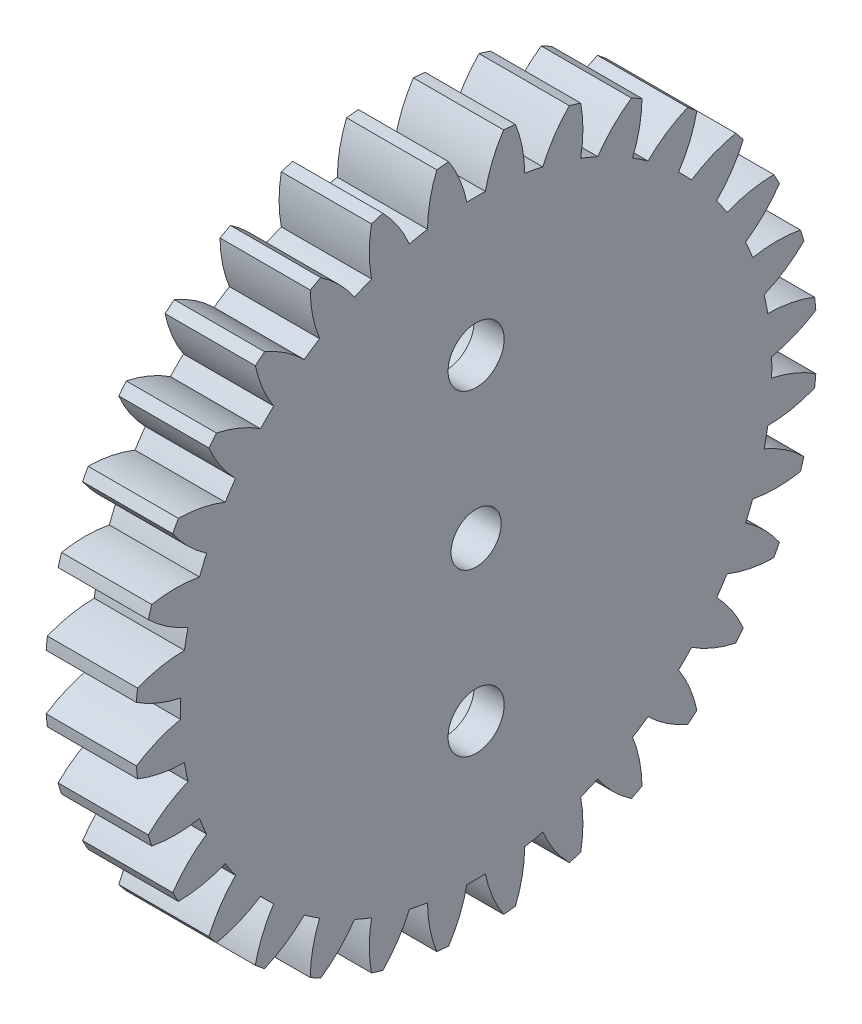
from build123d import *

# Parameters (mm, degrees)
BASPROSKE_W        = 4.5
BASPROSKE_H        = 17
TOOTHCUT_DEPTH     = 25.459149617
TEETHCUTS_COUNT    = 32
TEETHCUTS_ANGLE    = 348.75
BORSKE_R           = 1.25
BORE_DEPTH         = 50.0009652
SKETCH8_R          = 1.4
CUT_EXTRUDE8_DEPTH = 25.382197983
SKETCH9_R          = 2.5
CUT_EXTRUDE9_DEPTH = 3


with BuildPart() as part:
    # BasProSke → Base-Revolve (revolve)
    with BuildSketch(Plane(origin=(0, 0, 0), x_dir=(1, 0, 0), z_dir=(0, 1, 0)), mode=Mode.PRIVATE) as base_revolve_sk:
        with Locations((2.25, 8.5)):
            Rectangle(BASPROSKE_W, BASPROSKE_H)
    revolve(base_revolve_sk.sketch.rotate(Axis((-10, 0, 0), (1, 0, 0)), 180), axis=Axis((-10, 0, 0), (1, 0, 0)))

    # TooCutSke → ToothCut (cut, through all)
    with BuildSketch(Plane(origin=(0, 0, 0), x_dir=(0, 0, -1), z_dir=(1, 0, 0))):
        with BuildLine():
            ThreePointArc((0.462036907, 14.741761187), (0, 14.749), (-0.462036907, 14.741761187))
            ThreePointArc((-0.462036907, 14.741761187), (-0.81854142, 15.899240468), (-1.386721275, 16.9688317))
            ThreePointArc((-1.386721275, 16.9688317), (0, 17.0254), (1.386721275, 16.9688317))
            ThreePointArc((1.386721275, 16.9688317), (0.81854142, 15.899240468), (0.462036907, 14.741761187))
        make_face()
    toothcut = extrude(amount=TOOTHCUT_DEPTH, mode=Mode.SUBTRACT)

    # TeethCuts: ToothCut ×32 about axis
    teethcuts_axis = Axis((-10, 0, 0), (1, 0, 0))
    for i in range(1, TEETHCUTS_COUNT):
        add(toothcut.rotate(teethcuts_axis, i * TEETHCUTS_ANGLE / (TEETHCUTS_COUNT - 1)), mode=Mode.SUBTRACT)

    # BorSke → Bore (cut, symmetric)
    with BuildSketch(Plane(origin=(0, 0, 0), x_dir=(0, 0, -1), z_dir=(1, 0, 0))):
        with Locations(Location((0, 0, 0), (0, 0, 180))):
            Circle(BORSKE_R)
    extrude(amount=BORE_DEPTH, both=True, mode=Mode.SUBTRACT)

    # Sketch8 → Cut-Extrude8 (cut, through all)
    with BuildSketch(Plane(origin=(4.5, 0, 0), x_dir=(0, 0, -1), z_dir=(1, 0, 0))):
        with Locations((0, 7.9)):
            Circle(SKETCH8_R)
        with Locations((0, -7.9)):
            Circle(SKETCH8_R)
    extrude(amount=-CUT_EXTRUDE8_DEPTH, mode=Mode.SUBTRACT)

    # Sketch9 → Cut-Extrude9 (cut)
    with BuildSketch(Plane.ZY):
        with Locations((0, 7.9)):
            Circle(SKETCH9_R)
        with Locations((0, -7.9)):
            Circle(SKETCH9_R)
    extrude(amount=-CUT_EXTRUDE9_DEPTH, mode=Mode.SUBTRACT)


solid = part.part
